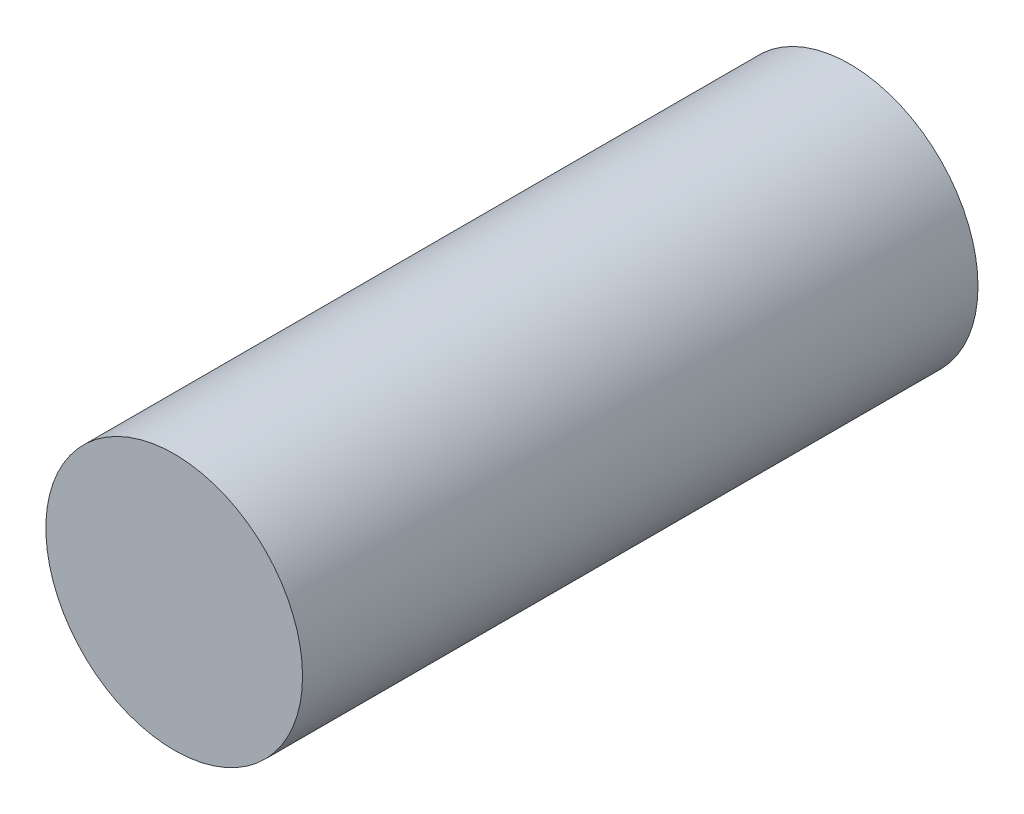
from build123d import *

# Parameters (mm, degrees)
SKETCH1_R           = 4.75
BOSS_EXTRUDE1_DEPTH = 25


with BuildPart() as part:
    # Sketch1 → Boss-Extrude1 (new body)
    with BuildSketch(Plane.XY):
        Circle(SKETCH1_R)
    extrude(amount=-BOSS_EXTRUDE1_DEPTH)


solid = part.part
